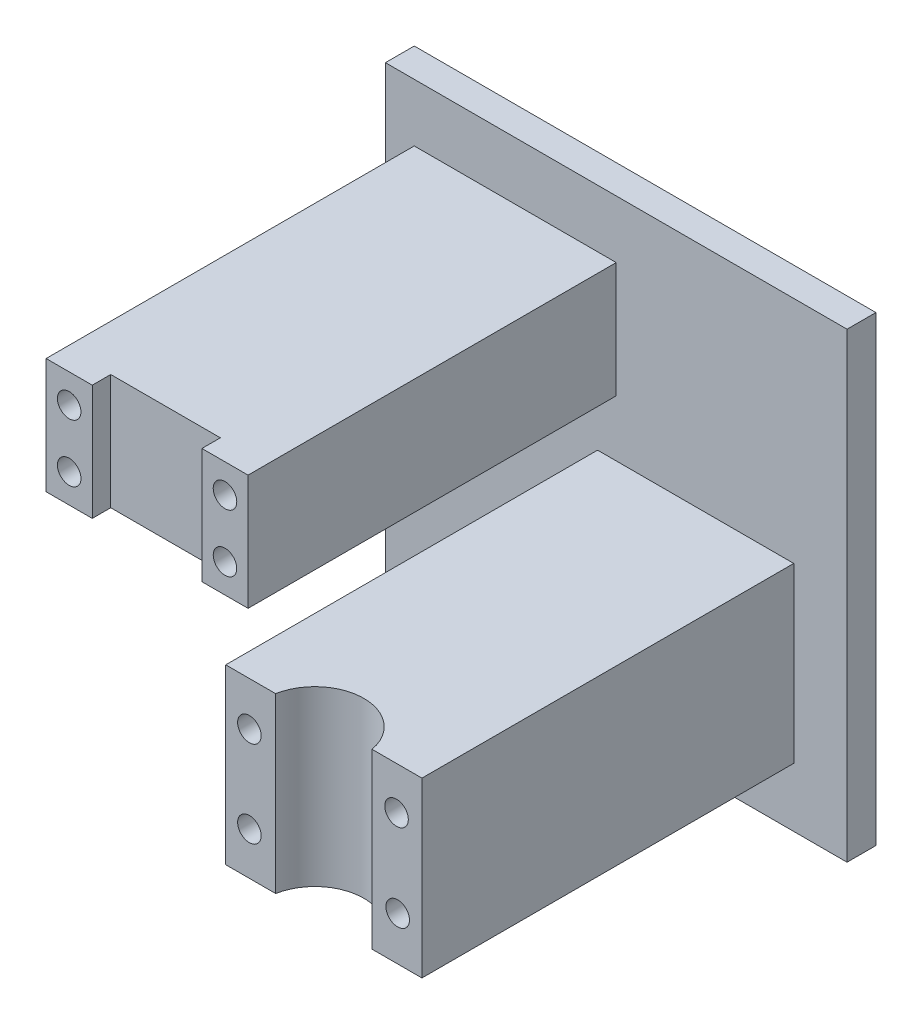
from build123d import *

# Parameters (mm, degrees)
SKETCH1_W                      = 101.6
SKETCH1_H                      = 101.6
BOSS_EXTRUDE1_DEPTH            = 6.35
SKETCH2_W                      = 44.45
SKETCH2_H                      = 25.4
BOSS_EXTRUDE3_DEPTH            = 101.6
SKETCH4_W                      = 24.13
SKETCH4_H                      = 11.938
CUT_EXTRUDE1_DEPTH             = 101.6
SKETCH5_W                      = 43.18
SKETCH5_H                      = 38.1
BOSS_EXTRUDE4_DEPTH            = 101.6
SKETCH6_R                      = 10.795
CUT_EXTRUDE2_DEPTH             = 157.799568366
SKETCH7_W                      = 43.18
SKETCH7_H                      = 17.859873976
CUT_EXTRUDE3_DEPTH             = 157.799568366
CUT_EXTRUDE4_REACH             = 174.855
SKETCH8_W                      = 44.45
SKETCH8_H                      = 18.669
F_6_0_204_DIAMETER_HOLE1_D     = 5.1816
F_6_0_204_DIAMETER_HOLE1_DEPTH = 12.7
F_6_0_204_DIAMETER_HOLE1_TIP   = 1.556709692
F_6_0_204_DIAMETER_HOLE2_D     = 5.1816
F_6_0_204_DIAMETER_HOLE2_DEPTH = 12.7
F_6_0_204_DIAMETER_HOLE2_TIP   = 1.556709692
CUT_EXTRUDE5_START             = -38.1
SKETCH17_W                     = 43.18
SKETCH17_H                     = 1.905
CUT_EXTRUDE5_DEPTH             = 38.1
CUT_EXTRUDE6_START             = -25.4
SKETCH18_W                     = 44.45
SKETCH18_H                     = 1.905
CUT_EXTRUDE6_DEPTH             = 25.4


with BuildPart() as part:
    # Sketch1 → Boss-Extrude1 (new body)
    with BuildSketch(Plane.XY):
        with Locations((-50.8, 50.8)):
            Rectangle(SKETCH1_W, SKETCH1_H)
    extrude(amount=BOSS_EXTRUDE1_DEPTH)

    # Sketch2 → Boss-Extrude3 (add)
    with BuildSketch(Plane.XY.offset(6.35)):
        with Locations((-73.025, 76.2)):
            Rectangle(SKETCH2_W, SKETCH2_H)
    extrude(amount=BOSS_EXTRUDE3_DEPTH)

    # Sketch4 → Cut-Extrude1 (cut)
    with BuildSketch(Plane.XZ.offset(-63.5)):
        with Locations((-73.025, 89.281)):
            Rectangle(SKETCH4_W, SKETCH4_H)
    extrude(amount=-CUT_EXTRUDE1_DEPTH, mode=Mode.SUBTRACT)

    # Sketch5 → Boss-Extrude4 (add)
    with BuildSketch(Plane.XY.offset(6.35)):
        with Locations((-33.315999359, 32.041507513)):
            Rectangle(SKETCH5_W, SKETCH5_H)
    extrude(amount=BOSS_EXTRUDE4_DEPTH)

    # Sketch6 → Cut-Extrude2 (cut, through all)
    with BuildSketch(Plane(origin=(0, 51.091507513, 0), x_dir=(1, 0, 0), z_dir=(0, 1, 0))):
        with Locations(Location((-33.315999359, -90.17, 0), (0, 0, 270))):
            Circle(SKETCH6_R)
    extrude(amount=-CUT_EXTRUDE2_DEPTH, mode=Mode.SUBTRACT)

    # Sketch7 → Cut-Extrude3 (cut, through all)
    with BuildSketch(Plane(origin=(0, 51.091507513, 0), x_dir=(1, 0, 0), z_dir=(0, 1, 0))):
        with Locations((-33.315999359, -99.020063012)):
            Rectangle(SKETCH7_W, SKETCH7_H)
    extrude(amount=-CUT_EXTRUDE3_DEPTH, mode=Mode.SUBTRACT)

    # Sketch8 → Cut-Extrude4 (cut, up to next)
    with BuildSketch(Plane(origin=(0, 88.9, 0), x_dir=(1, 0, 0), z_dir=(0, 1, 0)), mode=Mode.PRIVATE) as cut_extrude4_sk1:
        with Locations((-73.025, -98.6155)):
            Rectangle(SKETCH8_W, SKETCH8_H)
    cut_extrude4_tool1 = extrude(cut_extrude4_sk1.sketch, amount=-CUT_EXTRUDE4_REACH, mode=Mode.PRIVATE) & part.part
    add(cut_extrude4_tool1.solids().sort_by_distance((-73.025, 88.9, 98.6155))[0], mode=Mode.SUBTRACT)

    # #6 (0.204) Diameter Hole1
    with Locations(Plane.XY.offset(90.090126024)):
        with Locations((-17.060294864, 22.643507513), (-17.313999359, 41.693507513), (-49.698703855, 41.439507513), (-49.698703855, 22.389507513)):
            Hole(F_6_0_204_DIAMETER_HOLE1_D / 2, depth=F_6_0_204_DIAMETER_HOLE1_DEPTH)
            with Locations((0, 0, -(F_6_0_204_DIAMETER_HOLE1_DEPTH + F_6_0_204_DIAMETER_HOLE1_TIP / 2))):  # 118° drill point
                Cone(0, F_6_0_204_DIAMETER_HOLE1_D / 2, F_6_0_204_DIAMETER_HOLE1_TIP, mode=Mode.SUBTRACT)

    # #6 (0.204) Diameter Hole2
    with Locations(Plane.XY.offset(89.281)):
        with Locations((-55.88, 82.55), (-55.88, 69.85), (-90.17, 82.55), (-90.17, 69.85)):
            Hole(F_6_0_204_DIAMETER_HOLE2_D / 2, depth=F_6_0_204_DIAMETER_HOLE2_DEPTH)
            with Locations((0, 0, -(F_6_0_204_DIAMETER_HOLE2_DEPTH + F_6_0_204_DIAMETER_HOLE2_TIP / 2))):  # 118° drill point
                Cone(0, F_6_0_204_DIAMETER_HOLE2_D / 2, F_6_0_204_DIAMETER_HOLE2_TIP, mode=Mode.SUBTRACT)

    # Sketch17 → Cut-Extrude5 (cut)
    with BuildSketch(Plane.XZ.offset(-12.991507513).offset(CUT_EXTRUDE5_START)):
        with Locations((-33.315999359, 89.137626024)):
            Rectangle(SKETCH17_W, SKETCH17_H)
    extrude(amount=CUT_EXTRUDE5_DEPTH, mode=Mode.SUBTRACT)

    # Sketch18 → Cut-Extrude6 (cut)
    with BuildSketch(Plane(origin=(0, 88.9, 0), x_dir=(1, 0, 0), z_dir=(0, 1, 0)).offset(CUT_EXTRUDE6_START)):
        with Locations((-73.025, -88.3285)):
            Rectangle(SKETCH18_W, SKETCH18_H)
    extrude(amount=CUT_EXTRUDE6_DEPTH, mode=Mode.SUBTRACT)


solid = part.part
